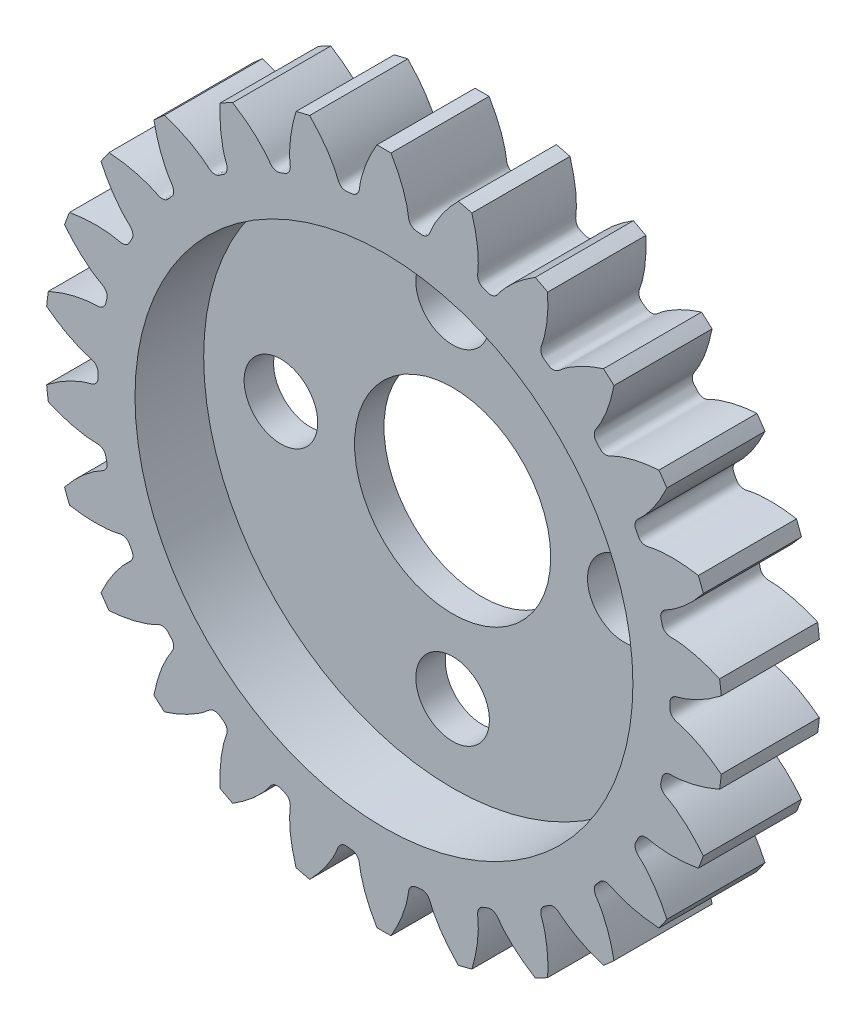
from build123d import *

# Parameters (mm, degrees)
SKETCHREVOLVESPURASSEMBLYNEW2PINION_W       = 4
SKETCHREVOLVESPURASSEMBLYNEW2PINION_H       = 13.822115385
TOOTHEXTRUDECUTSPURASSEMBLYNEW2PINION_DEPTH = 4
PATTERNSPURASSEMBLYNEW2PINION_COUNT         = 26
SKETCH_2_R                                  = 10.15
CUT_EXTRUDE_2_DEPTH                         = 2.8
SKETCH_1_R                                  = 1.5
SKETCH_1_R_2                                = 4
CUT_EXTRUDE_1_DEPTH                         = 20.698588769


with BuildPart() as part:
    # SketchRevolveSpurAssemblyNew2Pinion → SpurAssemblyNew2Pinion (revolve)
    with BuildSketch(Plane(origin=(0, 0, 0), x_dir=(0, 0, -1), z_dir=(1, 0, 0))):
        with Locations((-2, 6.911057693)):
            Rectangle(SKETCHREVOLVESPURASSEMBLYNEW2PINION_W, SKETCHREVOLVESPURASSEMBLYNEW2PINION_H)
    revolve(axis=Axis((0, 0, 0), (0, 0, -1)))

    # SketchToothSpurAssemblyNew2Pinion → ToothExtrudeCutSpurAssemblyNew2Pinion (cut, symmetric)
    with BuildSketch(Plane.XY):
        with BuildLine():
            ThreePointArc((13.81451757, 1.428912571), (13.888221154, 0), (13.81451757, -1.428912571))
            add(Edge.make_bspline(
                [(13.81451757, -1.428912571), (13.726688541, -1.359920515), (13.595197672, -1.261341012), (13.418856258, -1.138772461), (13.292585484, -1.055332348), (13.169877801, -0.978321954), (13.050962499, -0.907526114), (12.936060688, -0.842722426), (12.825385077, -0.783681639), (12.719139799, -0.730167838), (12.617520148, -0.681938938), (12.520712627, -0.638746252), (12.428893992, -0.600337203), (12.342233738, -0.566447419), (12.260885006, -0.536828638), (12.185014321, -0.511156667), (12.114702314, -0.489338003), (12.027112004, -0.463735243), (11.954138744, -0.448230597), (11.897794168, -0.427981043), (11.875856753, -0.418994985), (11.853410983, -0.408473503), (11.830202837, -0.395946023), (11.805975271, -0.380738879), (11.780539315, -0.361904625), (11.753919073, -0.33815527), (11.726633215, -0.307873546), (11.700089703, -0.269352659), (11.677071777, -0.221496801), (11.661562379, -0.16645758), (11.656168867, -0.09130535), (11.660269272, 0), (11.656168867, 0.09130535), (11.661562379, 0.16645758), (11.677071777, 0.221496801), (11.700089703, 0.269352659), (11.726633215, 0.307873546), (11.753919073, 0.33815527), (11.780539315, 0.361904625), (11.805975271, 0.380738879), (11.830202837, 0.395946023), (11.853410983, 0.408473503), (11.875856753, 0.418994985), (11.897794168, 0.427981043), (11.954138744, 0.448230597), (12.027112004, 0.463735243), (12.114702314, 0.489338003), (12.185014321, 0.511156667), (12.260885006, 0.536828638), (12.342233738, 0.566447419), (12.428893992, 0.600337203), (12.520712627, 0.638746252), (12.617520148, 0.681938938), (12.719139799, 0.730167838), (12.825385077, 0.783681639), (12.936060688, 0.842722426), (13.050962499, 0.907526114), (13.169877801, 0.978321954), (13.292585484, 1.055332348), (13.418856258, 1.138772461), (13.595197672, 1.261341012), (13.726688541, 1.359920515), (13.81451757, 1.428912571)],
                knots=[0, 0, 0, 0, 0.061765594, 0.090857399, 0.118755208, 0.145459022, 0.170968841, 0.195284665, 0.218406493, 0.240334327, 0.261068165, 0.280608009, 0.298953857, 0.31610571, 0.332063567, 0.34682743, 0.360397297, 0.37277317, 0.397298679, 0.401522405, 0.405867911, 0.410405301, 0.415225201, 0.420444455, 0.426211586, 0.432708636, 0.440141309, 0.448702283, 0.458489871, 0.469387514, 0.480099546, 0.5, 0.519900454, 0.530612486, 0.541510129, 0.551297717, 0.559858691, 0.567291364, 0.573788414, 0.579555545, 0.584774799, 0.589594699, 0.594132089, 0.598477595, 0.602701321, 0.62722683, 0.639602703, 0.65317257, 0.667936433, 0.68389429, 0.701046143, 0.719391991, 0.738931835, 0.759665673, 0.781593507, 0.804715335, 0.829031159, 0.854540978, 0.881244792, 0.909142601, 0.938234406, 1, 1, 1, 1], degree=3))
        make_face()
    toothextrudecutspurassemblynew2pinion = extrude(amount=TOOTHEXTRUDECUTSPURASSEMBLYNEW2PINION_DEPTH, both=True, mode=Mode.SUBTRACT)

    # PatternSpurAssemblyNew2Pinion: ToothExtrudeCutSpurAssemblyNew2Pinion ×26 about axis
    patternspurassemblynew2pinion_axis = Axis((0, 0, 50), (0, 0, -1))
    for i in range(1, PATTERNSPURASSEMBLYNEW2PINION_COUNT):
        add(toothextrudecutspurassemblynew2pinion.rotate(patternspurassemblynew2pinion_axis, i * 360 / PATTERNSPURASSEMBLYNEW2PINION_COUNT), mode=Mode.SUBTRACT)

    # Эскиз2 → Вырез-Вытянуть2 (cut)
    with BuildSketch(Plane.XY.offset(4)):
        Circle(SKETCH_2_R)
    extrude(amount=-CUT_EXTRUDE_2_DEPTH, mode=Mode.SUBTRACT)

    # Эскиз1 → Вырез-Вытянуть1 (cut, through all)
    with BuildSketch(Plane.XY.offset(1.2)):
        with Locations((0, 7)):
            Circle(SKETCH_1_R)
        with Locations((7, 0)):
            Circle(SKETCH_1_R)
        with Locations((0, -7)):
            Circle(SKETCH_1_R)
        with Locations((-7, 0)):
            Circle(SKETCH_1_R)
        Circle(SKETCH_1_R_2)
    extrude(amount=-CUT_EXTRUDE_1_DEPTH, mode=Mode.SUBTRACT)


solid = part.part
